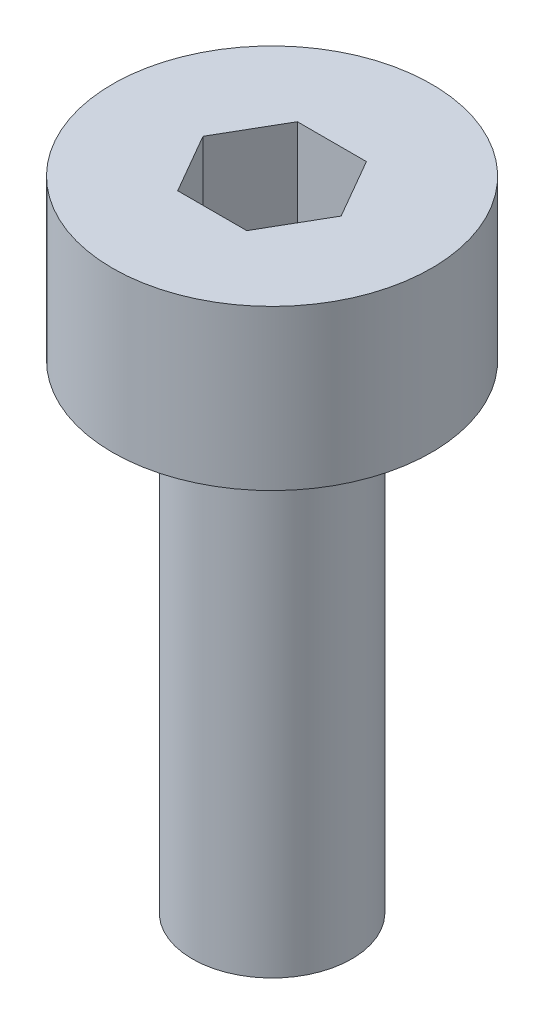
from build123d import *

# Parameters (mm, degrees)
SKETCH1_R           = 2
BOSS_EXTRUDE1_DEPTH = 12
SKETCH2_R           = 4
BOSS_EXTRUDE2_DEPTH = 4
CUT_EXTRUDE1_DEPTH  = 2.5


with BuildPart() as part:
    # Sketch1 → Boss-Extrude1 (new body)
    with BuildSketch(Plane(origin=(0, 0, 0), x_dir=(1, 0, 0), z_dir=(0, 1, 0))):
        with Locations(Location((0, 0, 0), (0, 0, 270))):
            Circle(SKETCH1_R)
    extrude(amount=BOSS_EXTRUDE1_DEPTH)

    # Sketch2 → Boss-Extrude2 (add)
    with BuildSketch(Plane(origin=(0, 12, 0), x_dir=(1, 0, 0), z_dir=(0, 1, 0))):
        with Locations(Location((0, 0, 0), (0, 0, 270))):
            Circle(SKETCH2_R)
    extrude(amount=BOSS_EXTRUDE2_DEPTH)

    # Sketch3 → Cut-Extrude1 (cut)
    with BuildSketch(Plane(origin=(0, 16, 0), x_dir=(1, 0, 0), z_dir=(0, 1, 0))):
        Polygon((1.732050808, 0), (0.866025404, 1.5), (-0.866025404, 1.5), (-1.732050808, 0), (-0.866025404, -1.5), (0.866025404, -1.5), align=None)
    extrude(amount=-CUT_EXTRUDE1_DEPTH, mode=Mode.SUBTRACT)


solid = part.part
